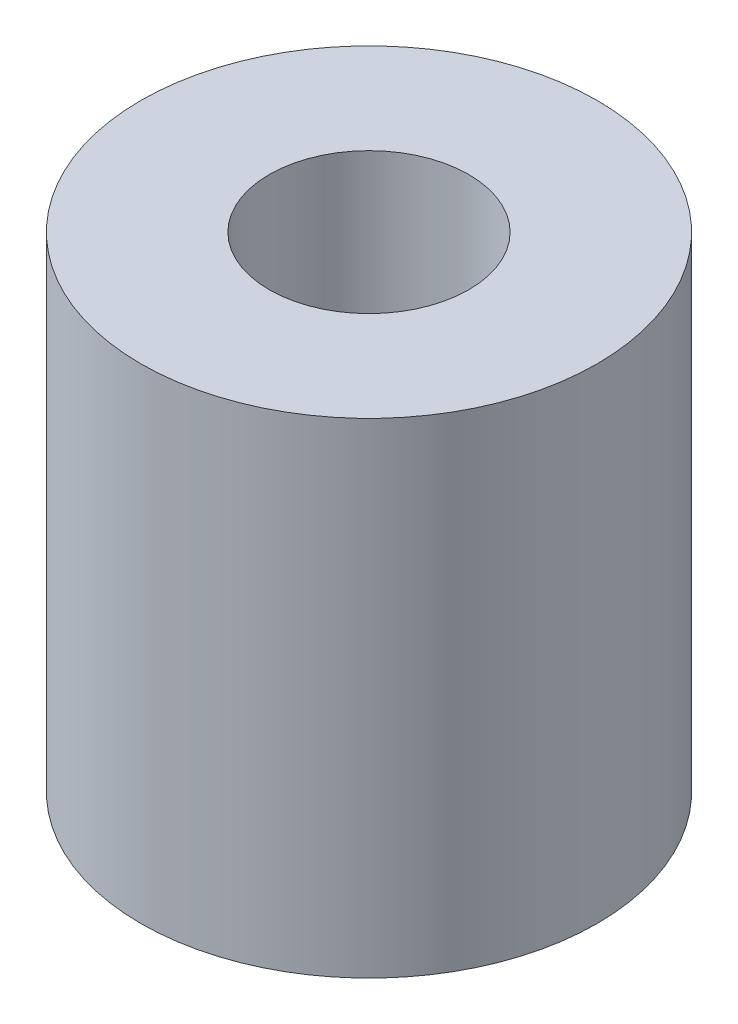
from build123d import *

# Parameters (mm, degrees)
SKETCH_1_R      = 4
SKETCH_1_R_2    = 1.75
EXTRUDE_1_DEPTH = 8.5


with BuildPart() as part:
    # Эскиз1 → Бобышка-Вытянуть1 (new body)
    with BuildSketch(Plane(origin=(0, 0, 0), x_dir=(1, 0, 0), z_dir=(0, 1, 0))):
        with Locations(Location((0, 0, 0), (0, 0, 270))):
            Circle(SKETCH_1_R)
        with Locations(Location((0, 0, 0), (0, 0, 270))):
            Circle(SKETCH_1_R_2, mode=Mode.SUBTRACT)
    extrude(amount=EXTRUDE_1_DEPTH)


solid = part.part
